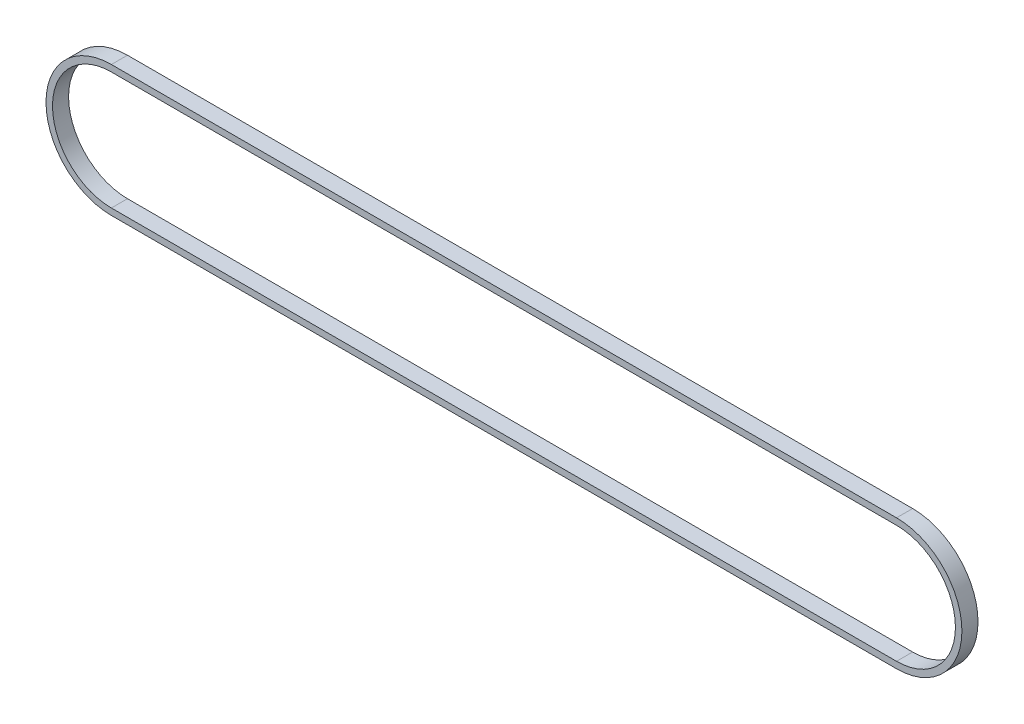
from build123d import *

# Parameters (mm, degrees)
SALIENTE_EXTRUIR3_DEPTH = 82


with BuildPart() as part:
    # Croquis1 → Saliente-Extruir3 (new body)
    with BuildSketch(Plane.XY):
        with BuildLine():
            Line((8362.994676577, 118.338980378), (4362.994676577, 118.338980378))
            ThreePointArc((4362.994676577, 118.338980378), (4029.930665551, -214.725030648), (4362.994676577, -547.789041674))
            Line((4362.994676577, -547.789041674), (8362.994676577, -547.789041674))
            ThreePointArc((8362.994676577, -547.789041674), (8696.058687603, -214.725030648), (8362.994676577, 118.338980378))
        make_face()
        with BuildLine():
            Line((4362.994676577, 85.274969352), (8362.994676577, 85.274969352))
            ThreePointArc((8362.994676577, 85.274969352), (8662.994676577, -214.725030648), (8362.994676577, -514.725030648))
            Line((8362.994676577, -514.725030648), (4362.994676577, -514.725030648))
            ThreePointArc((4362.994676577, -514.725030648), (4062.994676577, -214.725030648), (4362.994676577, 85.274969352))
        make_face(mode=Mode.SUBTRACT)
    extrude(amount=SALIENTE_EXTRUIR3_DEPTH)


solid = part.part
